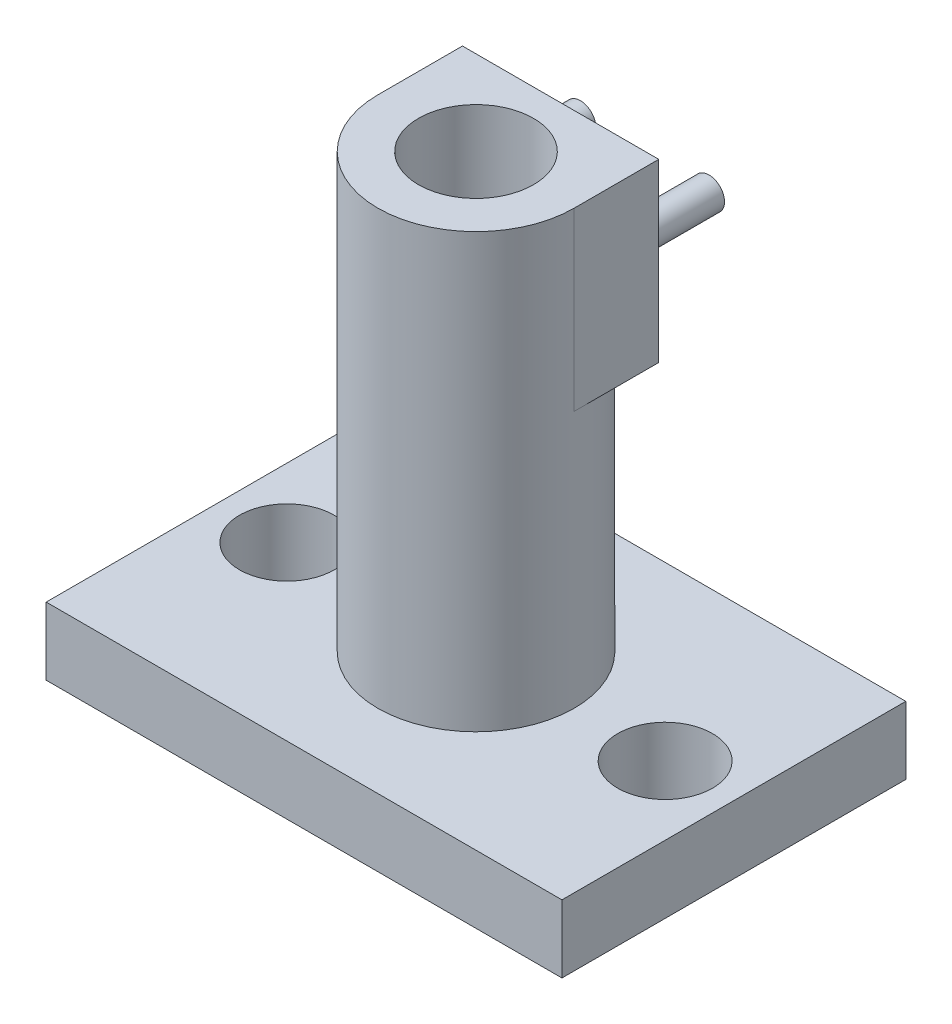
from build123d import *

# Parameters (mm, degrees)
SKETCH1_W           = 38.1
SKETCH1_H           = 25.4
BOSS_EXTRUDE1_DEPTH = 5
SKETCH3_R           = 7.25
SKETCH3_R_2         = 4.25
BOSS_EXTRUDE2_DEPTH = 32
SKETCH4_R           = 3.5
CUT_EXTRUDE1_DEPTH  = 44.047479384
CUT_EXTRUDE2_START  = -18
CUT_EXTRUDE2_DEPTH  = 18
BOSS_EXTRUDE3_START = -13
BOSS_EXTRUDE3_DEPTH = 13
SKETCH9_R           = 1.15
BOSS_EXTRUDE4_DEPTH = 6.21


with BuildPart() as part:
    # Sketch1 → Boss-Extrude1 (new body)
    with BuildSketch(Plane(origin=(0, 0, 0), x_dir=(1, 0, 0), z_dir=(0, 1, 0))):
        with Locations((-6.79173913, 0)):
            Rectangle(SKETCH1_W, SKETCH1_H)
    extrude(amount=BOSS_EXTRUDE1_DEPTH)

    # Sketch3 → Boss-Extrude2 (add)
    with BuildSketch(Plane(origin=(0, 5, 0), x_dir=(1, 0, 0), z_dir=(0, 1, 0))):
        with Locations((-6.79173913, 0)):
            Circle(SKETCH3_R)
        with Locations((-6.79173913, 0)):
            Circle(SKETCH3_R_2, mode=Mode.SUBTRACT)
    extrude(amount=BOSS_EXTRUDE2_DEPTH)

    # Sketch4 → Cut-Extrude1 (cut, through all)
    with BuildSketch(Plane(origin=(0, 5, 0), x_dir=(1, 0, 0), z_dir=(0, 1, 0))):
        with Locations((7.17826087, 0)):
            Circle(SKETCH4_R)
        with Locations((-20.76173913, 0)):
            Circle(SKETCH4_R)
    extrude(amount=-CUT_EXTRUDE1_DEPTH, mode=Mode.SUBTRACT)

    # Sketch6 → Cut-Extrude2 (cut)
    with BuildSketch(Plane(origin=(0, 37, 0), x_dir=(1, 0, 0), z_dir=(0, 1, 0)).offset(CUT_EXTRUDE2_START)):
        with BuildLine():
            Line((-3.117504516, 6.25), (-10.465973745, 6.25))
            ThreePointArc((-10.465973745, 6.25), (-6.79173913, 7.25), (-3.117504516, 6.25))
        make_face()
    extrude(amount=CUT_EXTRUDE2_DEPTH, mode=Mode.SUBTRACT)

    # Sketch8 → Boss-Extrude3 (add)
    with BuildSketch(Plane(origin=(0, 37, 0), x_dir=(1, 0, 0), z_dir=(0, 1, 0)).offset(BOSS_EXTRUDE3_START)):
        with BuildLine():
            Line((-14.04173913, 6.25), (-10.465973745, 6.25))
            ThreePointArc((-10.465973745, 6.25), (-13.084620067, 3.600298533), (-14.04173913, 0))
            Line((-14.04173913, 0), (-14.04173913, 6.25))
        make_face()
        with BuildLine():
            Line((0.45826087, 0), (0.45826087, 6.25))
            Line((0.45826087, 6.25), (-3.117504516, 6.25))
            ThreePointArc((-3.117504516, 6.25), (-0.498858194, 3.600298533), (0.45826087, 0))
        make_face()
    extrude(amount=BOSS_EXTRUDE3_DEPTH)

    # Sketch9 → Boss-Extrude4 (add)
    with BuildSketch(Plane(origin=(0, 0, -6.25), x_dir=(-1, 0, 0), z_dir=(0, 0, -1))):
        with Locations((2.04173913, 30.5)):
            Circle(SKETCH9_R)
        with Locations((11.54173913, 30.5)):
            Circle(SKETCH9_R)
    extrude(amount=BOSS_EXTRUDE4_DEPTH)


solid = part.part
